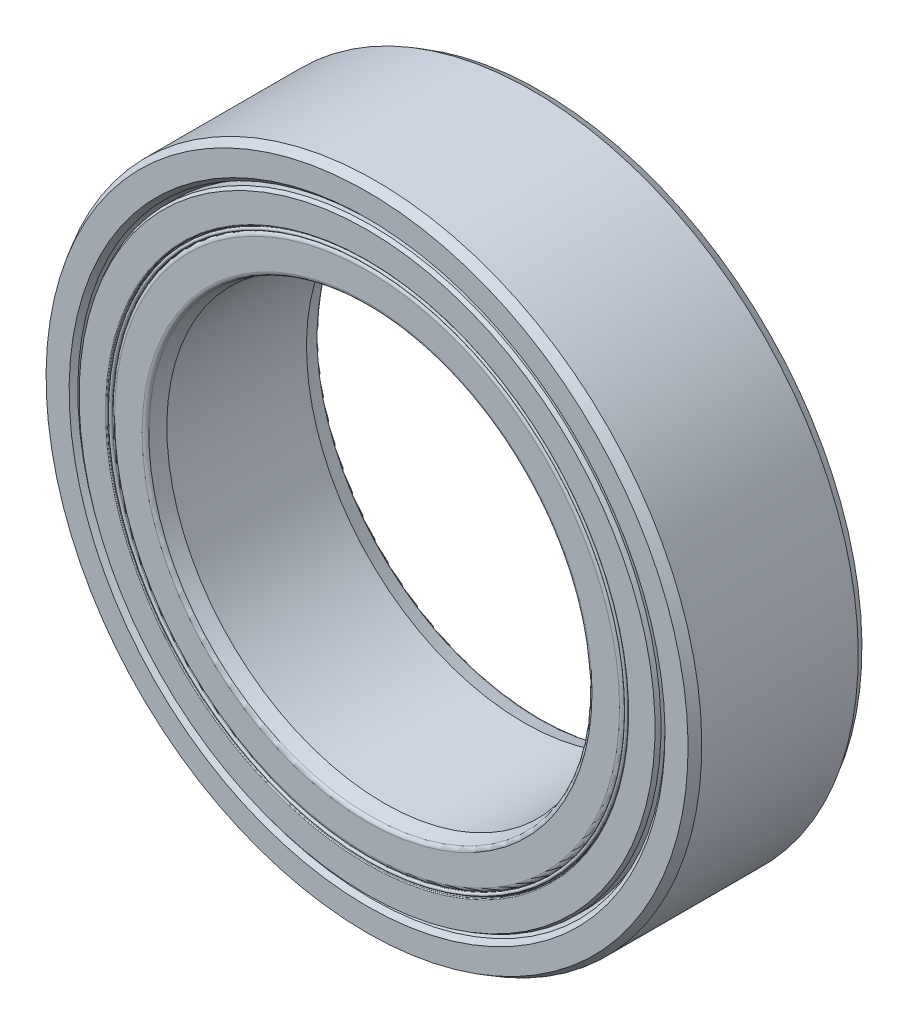
from build123d import *

# Parameters (mm, degrees)
CIRPATTERN1_COUNT = 14


with BuildPart() as part:
    # Sketch3 → Revolve1 (revolve)
    with BuildSketch(Plane(origin=(0, 0, 0), x_dir=(0, 0, -1), z_dir=(1, 0, 0)), mode=Mode.PRIVATE) as revolve1_sk:
        with BuildLine():
            Line((-1.682987285, 6.675), (-1.9, 6.753986169))
            Line((-1.9, 6.753986169), (-2, 6.853986169))
            Line((-2, 6.853986169), (-2, 7.384529946))
            Line((-2, 7.384529946), (-1.8, 7.5))
            Line((-1.8, 7.5), (1.8, 7.5))
            Line((1.8, 7.5), (2, 7.384529946))
            Line((2, 7.384529946), (2, 6.853986169))
            Line((2, 6.853986169), (1.9, 6.753986169))
            Line((1.9, 6.753986169), (1.682987285, 6.675))
            Line((1.682987285, 6.675), (0.853668554, 6.675))
            ThreePointArc((0.853668554, 6.675), (0, 7.225), (-0.853668554, 6.675))
            Line((-0.853668554, 6.675), (-1.682987285, 6.675))
        make_face()
    revolve(revolve1_sk.sketch.rotate(Axis((0, 0, 2), (0, 0, -1)), 180), axis=Axis((0, 0, 2), (0, 0, -1)))


with BuildPart() as body_2:
    # Sketch4 → Revolve2 (revolve)
    with BuildSketch(Plane(origin=(0, 0, 0), x_dir=(0, 0, -1), z_dir=(1, 0, 0)), mode=Mode.PRIVATE) as revolve2_sk:
        with BuildLine():
            Line((-1.606304443, 5), (-1.932858889, 5.0875))
            ThreePointArc((-1.932858889, 5.0875), (-1.981280568, 5.119854332), (-2, 5.175))
            Line((-2, 5.175), (-2, 5.809413334))
            ThreePointArc((-2, 5.809413334), (-1.97346778, 5.87346778), (-1.909413334, 5.9))
            Line((-1.909413334, 5.9), (-0.853668554, 5.9))
            ThreePointArc((-0.853668554, 5.9), (0, 5.35), (0.853668554, 5.9))
            Line((0.853668554, 5.9), (1.909413334, 5.9))
            ThreePointArc((1.909413334, 5.9), (1.97346778, 5.87346778), (2, 5.809413334))
            Line((2, 5.809413334), (2, 5.175))
            ThreePointArc((2, 5.175), (1.981280568, 5.119854332), (1.932858889, 5.0875))
            Line((1.932858889, 5.0875), (1.606304443, 5))
            Line((1.606304443, 5), (-1.606304443, 5))
        make_face()
    revolve(revolve2_sk.sketch.rotate(Axis((0, 0, 2), (0, 0, -1)), 180), axis=Axis((0, 0, 2), (0, 0, -1)))


with BuildPart() as body_3:
    # Sketch5 → Revolve3 (revolve)
    with BuildSketch(Plane(origin=(0, 0, 0), x_dir=(0, 0, -1), z_dir=(1, 0, 0))):
        with BuildLine():
            Line((-0.9375, 6.2875), (0.9375, 6.2875))
            ThreePointArc((0.9375, 6.2875), (0, 7.225), (-0.9375, 6.2875))
        make_face()
    revolve(axis=Axis((0, 6.2875, 0.9375), (0, 0, -1)))


with BuildPart() as cirpattern1_1:
    # CirPattern1: pattern copy
    add(body_3.part.rotate(Axis((0, 0, 0), (0, 0, 1)), 1 * 360 / CIRPATTERN1_COUNT))


with BuildPart() as cirpattern1_2:
    # CirPattern1: pattern copy
    add(body_3.part.rotate(Axis((0, 0, 0), (0, 0, 1)), 2 * 360 / CIRPATTERN1_COUNT))


with BuildPart() as cirpattern1_3:
    # CirPattern1: pattern copy
    add(body_3.part.rotate(Axis((0, 0, 0), (0, 0, 1)), 3 * 360 / CIRPATTERN1_COUNT))


with BuildPart() as cirpattern1_4:
    # CirPattern1: pattern copy
    add(body_3.part.rotate(Axis((0, 0, 0), (0, 0, 1)), 4 * 360 / CIRPATTERN1_COUNT))


with BuildPart() as cirpattern1_5:
    # CirPattern1: pattern copy
    add(body_3.part.rotate(Axis((0, 0, 0), (0, 0, 1)), 5 * 360 / CIRPATTERN1_COUNT))


with BuildPart() as cirpattern1_6:
    # CirPattern1: pattern copy
    add(body_3.part.rotate(Axis((0, 0, 0), (0, 0, 1)), 6 * 360 / CIRPATTERN1_COUNT))


with BuildPart() as cirpattern1_7:
    # CirPattern1: pattern copy
    add(body_3.part.rotate(Axis((0, 0, 0), (0, 0, 1)), 7 * 360 / CIRPATTERN1_COUNT))


with BuildPart() as cirpattern1_8:
    # CirPattern1: pattern copy
    add(body_3.part.rotate(Axis((0, 0, 0), (0, 0, 1)), 8 * 360 / CIRPATTERN1_COUNT))


with BuildPart() as cirpattern1_9:
    # CirPattern1: pattern copy
    add(body_3.part.rotate(Axis((0, 0, 0), (0, 0, 1)), 9 * 360 / CIRPATTERN1_COUNT))


with BuildPart() as cirpattern1_10:
    # CirPattern1: pattern copy
    add(body_3.part.rotate(Axis((0, 0, 0), (0, 0, 1)), 10 * 360 / CIRPATTERN1_COUNT))


with BuildPart() as cirpattern1_11:
    # CirPattern1: pattern copy
    add(body_3.part.rotate(Axis((0, 0, 0), (0, 0, 1)), 11 * 360 / CIRPATTERN1_COUNT))


with BuildPart() as cirpattern1_12:
    # CirPattern1: pattern copy
    add(body_3.part.rotate(Axis((0, 0, 0), (0, 0, 1)), 12 * 360 / CIRPATTERN1_COUNT))


with BuildPart() as cirpattern1_13:
    # CirPattern1: pattern copy
    add(body_3.part.rotate(Axis((0, 0, 0), (0, 0, 1)), 13 * 360 / CIRPATTERN1_COUNT))


with BuildPart() as body_17:
    # Sketch6 → Revolve4 (revolve)
    with BuildSketch(Plane(origin=(0, 0, 0), x_dir=(0, 0, -1), z_dir=(1, 0, 0)), mode=Mode.PRIVATE) as revolve4_sk:
        with BuildLine():
            Line((-1.91339746, 6.675), (-0.9375, 6.675))
            Line((-0.9375, 6.675), (-0.9375, 6))
            Line((-0.9375, 6), (-1.98, 6))
            ThreePointArc((-1.98, 6), (-1.994142136, 6.005857864), (-2, 6.02))
            Line((-2, 6.02), (-2, 6.625))
            Line((-2, 6.625), (-1.91339746, 6.675))
        make_face()
        with BuildLine():
            Line((1.98, 6), (0.9375, 6))
            Line((0.9375, 6), (0.9375, 6.675))
            Line((0.9375, 6.675), (1.91339746, 6.675))
            Line((1.91339746, 6.675), (2, 6.625))
            Line((2, 6.625), (2, 6.02))
            ThreePointArc((2, 6.02), (1.994142136, 6.005857864), (1.98, 6))
        make_face()
    revolve(revolve4_sk.sketch.rotate(Axis((0, 0, 2), (0, 0, -1)), 180), axis=Axis((0, 0, 2), (0, 0, -1)))


with BuildPart() as body_18:
    # Sketch7 → Revolve5 (revolve)
    with BuildSketch(Plane(origin=(0, 0, 0), x_dir=(0, 0, -1), z_dir=(1, 0, 0)), mode=Mode.PRIVATE) as revolve5_sk:
        with BuildLine():
            Line((-0.9375, 6), (-1.914687217, 6))
            Line((-1.914687217, 6), (-1.93930741, 5.995658796))
            ThreePointArc((-1.93930741, 5.995658796), (-1.947868854, 5.984501305), (-1.9375, 5.975))
            Line((-1.9375, 5.975), (-1.9625, 5.975))
            ThreePointArc((-1.9625, 5.975), (-2, 5.9375), (-1.9625, 5.9))
            Line((-1.9625, 5.9), (-0.9375, 5.9))
            Line((-0.9375, 5.9), (-0.9375, 6))
        make_face()
    revolve(revolve5_sk.sketch.rotate(Axis((0, 0, 2), (0, 0, -1)), 180), axis=Axis((0, 0, 2), (0, 0, -1)))


solid = Compound([part.part, body_2.part, body_3.part, cirpattern1_1.part, cirpattern1_2.part, cirpattern1_3.part, cirpattern1_4.part, cirpattern1_5.part, cirpattern1_6.part, cirpattern1_7.part, cirpattern1_8.part, cirpattern1_9.part, cirpattern1_10.part, cirpattern1_11.part, cirpattern1_12.part, cirpattern1_13.part, body_17.part, body_18.part])
